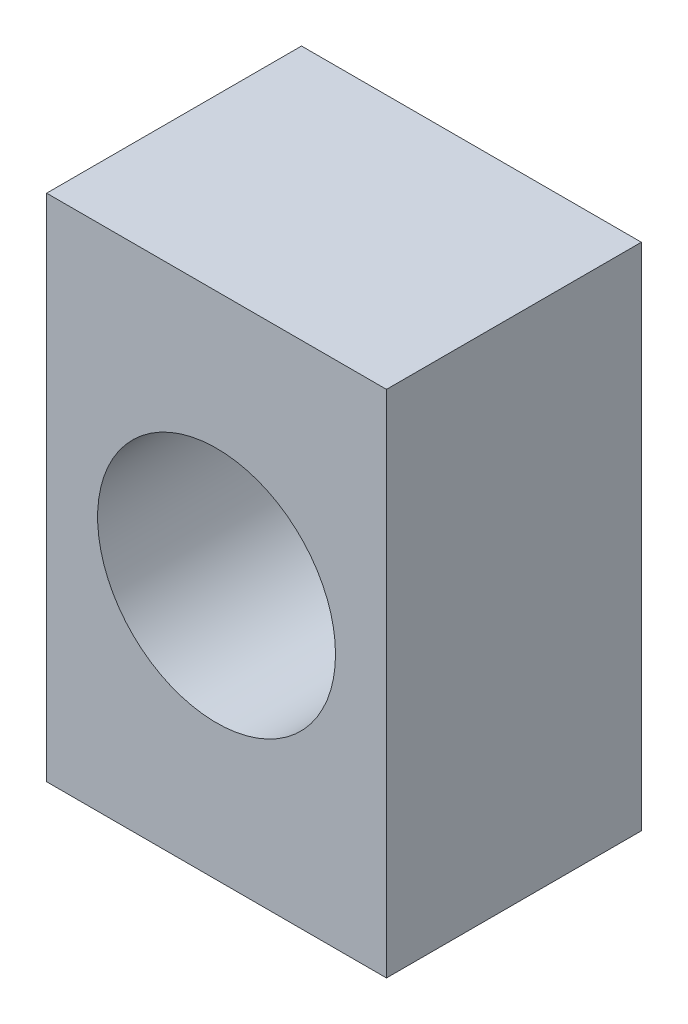
from build123d import *

# Parameters (mm, degrees)
SKETCH1_W           = 40
SKETCH1_H           = 60
SKETCH1_R           = 14
BOSS_EXTRUDE1_DEPTH = 27
SKETCH2_W           = 40
SKETCH2_H           = 60
SKETCH2_R           = 13
BOSS_EXTRUDE2_DEPTH = 3


with BuildPart() as part:
    # Sketch1 → Boss-Extrude1 (new body)
    with BuildSketch(Plane.XY):
        Rectangle(SKETCH1_W, SKETCH1_H)
        Circle(SKETCH1_R, mode=Mode.SUBTRACT)
    extrude(amount=BOSS_EXTRUDE1_DEPTH)

    # Sketch2 → Boss-Extrude2 (add)
    with BuildSketch(Plane(origin=(0, 0, 0), x_dir=(-1, 0, 0), z_dir=(0, 0, -1))):
        Rectangle(SKETCH2_W, SKETCH2_H)
        Circle(SKETCH2_R, mode=Mode.SUBTRACT)
    extrude(amount=BOSS_EXTRUDE2_DEPTH)


solid = part.part
